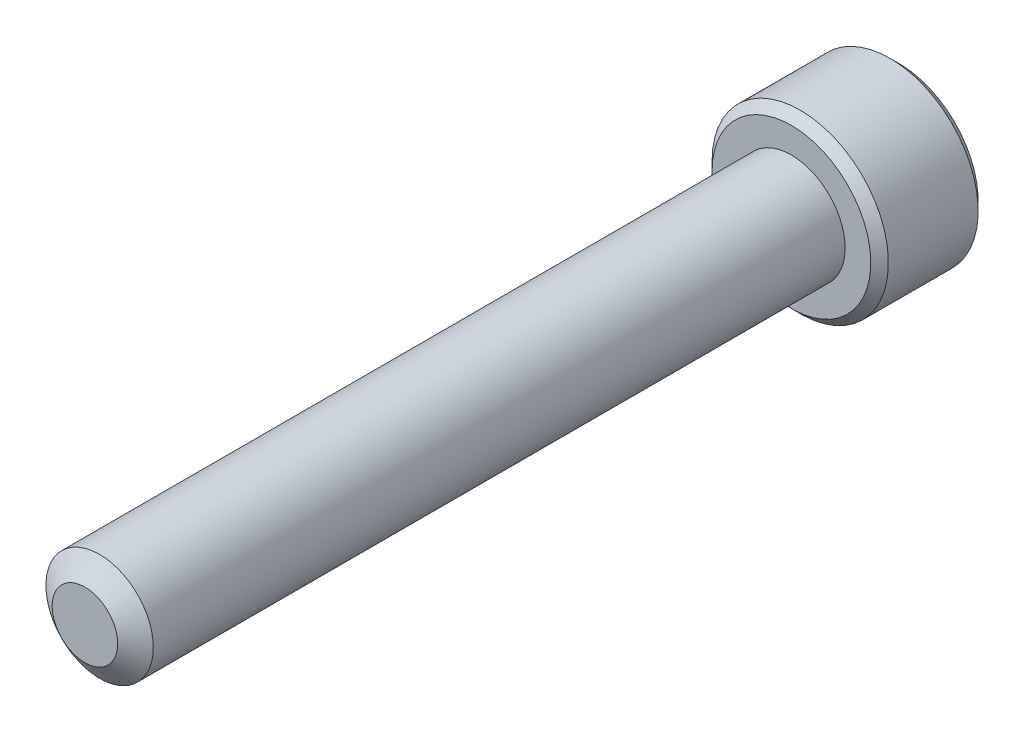
from build123d import *

# Parameters (mm, degrees)
SKETCH1_R          = 2.413
EXTRUDE1_DEPTH     = 31.75
SKETCH6_R          = 3.9624
EXTRUDE2_DEPTH     = 4.826
CUT_EXTRUDE1_DEPTH = 2.9765625
CHAMFER1_SIZE      = 0.39624


with BuildPart() as part:
    # Sketch1 → Extrude1 (new body)
    with BuildSketch(Plane.XY):
        Circle(SKETCH1_R)
    extrude(amount=-EXTRUDE1_DEPTH)

    # Sketch4 → Cut-Revolve1 (revolve, cut)
    with BuildSketch(Plane(origin=(0, 0, 0), x_dir=(0, 0, -1), z_dir=(1, 0, 0)), mode=Mode.PRIVATE) as cut_revolve1_sk:
        Polygon((0.659180743, 2.413), (0, 1.471592336), (0, 2.413), align=None)
    revolve(cut_revolve1_sk.sketch.rotate(Axis((0, 0, 0), (0, 0, -1)), 90), axis=Axis((0, 0, 0), (0, 0, -1)), mode=Mode.SUBTRACT)

    # Sketch6 → Extrude2 (add)
    with BuildSketch(Plane(origin=(0, 0, -31.75), x_dir=(-1, 0, 0), z_dir=(0, 0, -1))):
        Circle(SKETCH6_R)
    extrude(amount=EXTRUDE2_DEPTH)

    # Sketch7 → Cut-Extrude1 (cut)
    with BuildSketch(Plane(origin=(0, 0, -36.576), x_dir=(-1, 0, 0), z_dir=(0, 0, -1))):
        Polygon((0, 2.291358881), (-1.984375, 1.14567944), (-1.984375, -1.14567944), (0, -2.291358881), (1.984375, -1.14567944), (1.984375, 1.14567944), align=None)
    extrude(amount=-CUT_EXTRUDE1_DEPTH, mode=Mode.SUBTRACT)

    # Cut-Extrude2 cone 1 section (through the dimple's axis) → Cut-Extrude2 (revolve, cut)
    with BuildSketch(Plane(origin=(0, 0, -36.576), x_dir=(0, 1, 0), z_dir=(1, 0, 0))):
        Polygon((0, 0), (2.291358881, 0), (0, 2.291358881), align=None)
    revolve(axis=Axis((0, 0, -36.576), (0, 0, 1)), mode=Mode.SUBTRACT)

    # Chamfer1
    chamfer1_edges = [part.edges().sort_by_distance(p)[0] for p in [
        (3.9624, 0, -31.75),
        (3.9624, 0, -36.576),
    ]]
    chamfer(chamfer1_edges, length=CHAMFER1_SIZE)


solid = part.part
